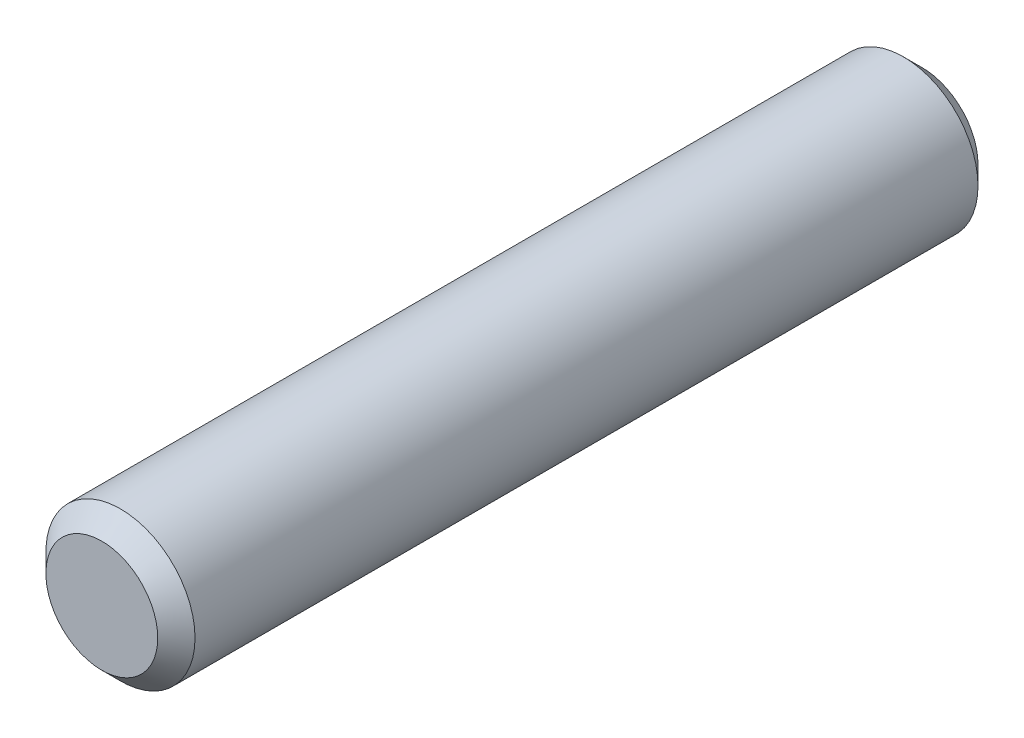
from build123d import *

# Parameters (mm, degrees)
SKETCH1_R           = 2
BOSS_EXTRUDE1_DEPTH = 22
CHAMFER1_SIZE       = 0.5


with BuildPart() as part:
    # Sketch1 → Boss-Extrude1 (new body)
    with BuildSketch(Plane.XY):
        Circle(SKETCH1_R)
    extrude(amount=BOSS_EXTRUDE1_DEPTH)

    # Chamfer1
    chamfer1_edges = [part.edges().sort_by_distance(p)[0] for p in [
        (-2, 0, 0),
        (-2, 0, 22),
    ]]
    chamfer(chamfer1_edges, length=CHAMFER1_SIZE)


solid = part.part
